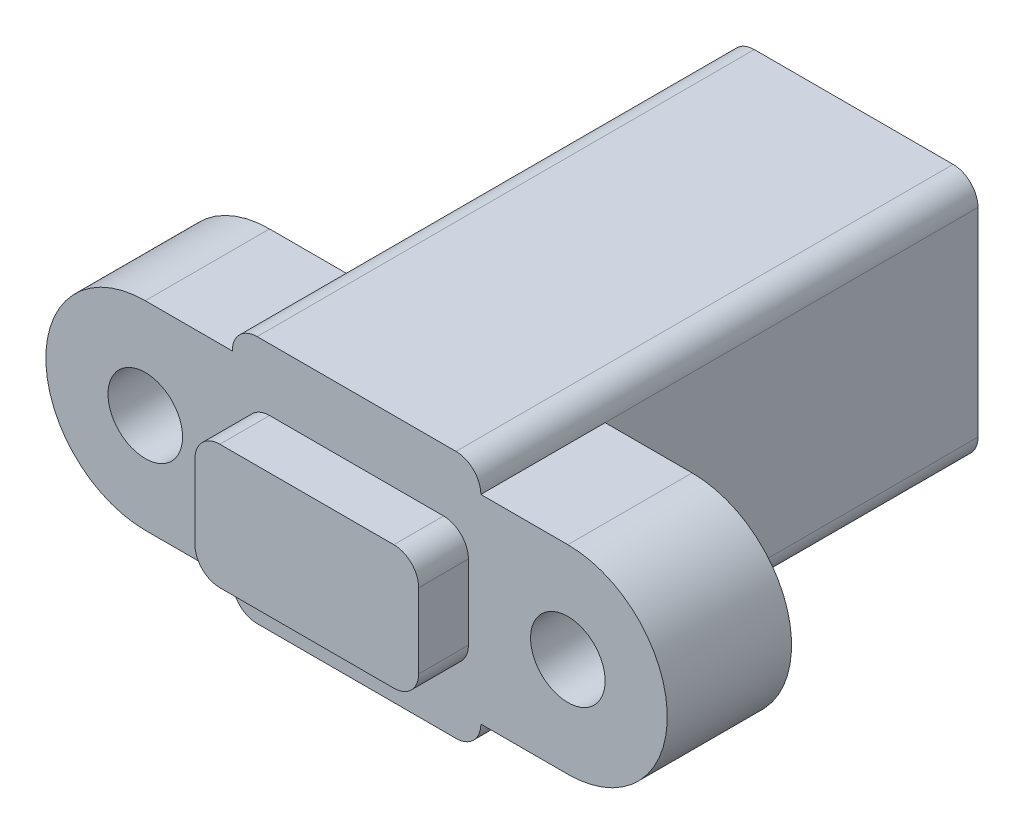
from build123d import *

# Parameters (mm, degrees)
SKETCH2_R           = 1.5
BOSS_EXTRUDE1_DEPTH = 5
BOSS_EXTRUDE2_DEPTH = 2
BOSS_EXTRUDE3_START = -15
BOSS_EXTRUDE3_DEPTH = 15


with BuildPart() as part:
    # Sketch2 → Boss-Extrude1 (new body)
    with BuildSketch(Plane.XY):
        with BuildLine():
            Line((0, 4), (-3.5, 4))
            ThreePointArc((-3.5, 4), (-3.792893219, 4.707106781), (-4.5, 5))
            Line((-4.5, 5), (-12.5, 5))
            ThreePointArc((-12.5, 5), (-13.207106781, 4.707106781), (-13.5, 4))
            Line((-13.5, 4), (-17, 4))
            ThreePointArc((-17, 4), (-21, 0), (-17, -4))
            Line((-17, -4), (-13.5, -4))
            ThreePointArc((-13.5, -4), (-13.207106781, -4.707106781), (-12.5, -5))
            Line((-12.5, -5), (-4.5, -5))
            ThreePointArc((-4.5, -5), (-3.792893219, -4.707106781), (-3.5, -4))
            Line((-3.5, -4), (0, -4))
            ThreePointArc((0, -4), (4, 0), (0, 4))
        make_face()
        Circle(SKETCH2_R, mode=Mode.SUBTRACT)
        with Locations((-17, 0)):
            Circle(SKETCH2_R, mode=Mode.SUBTRACT)
    extrude(amount=BOSS_EXTRUDE1_DEPTH)

    # Sketch3 → Boss-Extrude2 (add)
    with BuildSketch(Plane.XY.offset(5)):
        with BuildLine():
            Line((-12, -2.5), (-5, -2.5))
            ThreePointArc((-5, -2.5), (-4.292893219, -2.207106781), (-4, -1.5))
            Line((-4, -1.5), (-4, 1.5))
            ThreePointArc((-4, 1.5), (-4.292893219, 2.207106781), (-5, 2.5))
            Line((-5, 2.5), (-12, 2.5))
            ThreePointArc((-12, 2.5), (-12.707106781, 2.207106781), (-13, 1.5))
            Line((-13, 1.5), (-13, -1.5))
            ThreePointArc((-13, -1.5), (-12.707106781, -2.207106781), (-12, -2.5))
        make_face()
    extrude(amount=BOSS_EXTRUDE2_DEPTH)

    # Sketch2<3> → Boss-Extrude3 (add)
    with BuildSketch(Plane.XY.offset(BOSS_EXTRUDE3_START)):
        with BuildLine():
            Line((-3.5, -4), (-3.5, 4))
            ThreePointArc((-3.5, 4), (-3.792893219, 4.707106781), (-4.5, 5))
            Line((-4.5, 5), (-12.5, 5))
            ThreePointArc((-12.5, 5), (-13.207106781, 4.707106781), (-13.5, 4))
            Line((-13.5, 4), (-13.5, -4))
            ThreePointArc((-13.5, -4), (-13.207106781, -4.707106781), (-12.5, -5))
            Line((-12.5, -5), (-4.5, -5))
            ThreePointArc((-4.5, -5), (-3.792893219, -4.707106781), (-3.5, -4))
        make_face()
    extrude(amount=BOSS_EXTRUDE3_DEPTH)


solid = part.part
